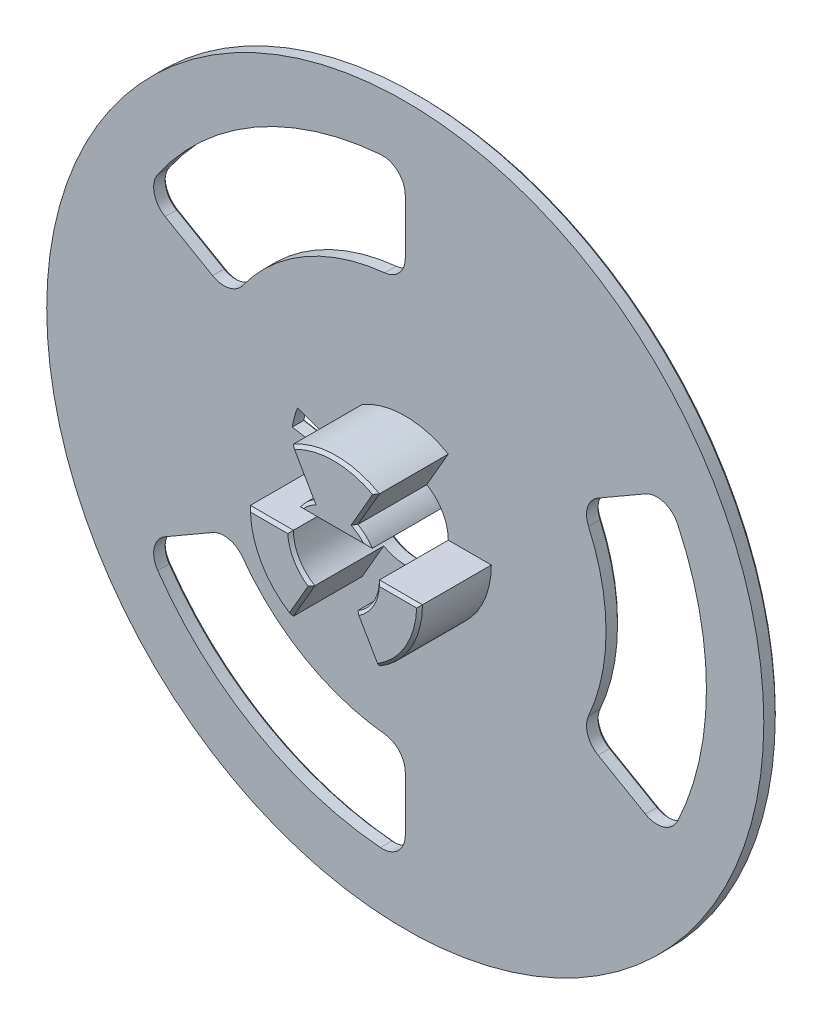
from build123d import *

# Parameters (mm, degrees)
SKETCH_1_R      = 25
EXTRUDE_1_DEPTH = 1
FILLET_1_R      = 1.6
EXTRUDE_START   = 5
EXTRUDE_3_DEPTH = 5
CHAMFER_3_SIZE  = 0.2


with BuildPart() as part:
    # 草图1 → 凸台-拉伸1 (new body)
    with BuildSketch(Plane.XY):
        Circle(SKETCH_1_R)
        with BuildLine():
            Line((-5.908846518, 1.041889066), (-7.878462024, 1.389185421))
            ThreePointArc((-7.878462024, 1.389185421), (-7.72740661, 2.070552361), (-7.517540966, 2.736161147))
            Line((-7.517540966, 2.736161147), (-5.638155725, 2.05212086))
            ThreePointArc((-5.638155725, 2.05212086), (-5.795554958, 1.552914271), (-5.908846518, 1.041889066))
        make_face(mode=Mode.SUBTRACT)
        with BuildLine():
            Line((-2.5, 1.658312395), (2.5, 1.658312395))
            ThreePointArc((2.5, 1.658312395), (0, -3), (-2.5, 1.658312395))
        make_face(mode=Mode.SUBTRACT)
        with BuildLine():
            ThreePointArc((-12.124355653, -7), (-7, -12.124355653), (0, -14))
            Line((0, -14), (0, -21))
            ThreePointArc((0, -21), (-10.5, -18.186533479), (-18.186533479, -10.5))
            Line((-18.186533479, -10.5), (-12.124355653, -7))
        make_face(mode=Mode.SUBTRACT)
        with BuildLine():
            ThreePointArc((0, 14), (-7, 12.124355653), (-12.124355653, 7))
            Line((-12.124355653, 7), (-18.186533479, 10.5))
            ThreePointArc((-18.186533479, 10.5), (-10.5, 18.186533479), (0, 21))
            Line((0, 21), (0, 14))
        make_face(mode=Mode.SUBTRACT)
        with BuildLine():
            ThreePointArc((18.186533479, 10.5), (21, 0), (18.186533479, -10.5))
            Line((18.186533479, -10.5), (12.124355653, -7))
            ThreePointArc((12.124355653, -7), (14, 0), (12.124355653, 7))
            Line((12.124355653, 7), (18.186533479, 10.5))
        make_face(mode=Mode.SUBTRACT)
    extrude(amount=-EXTRUDE_1_DEPTH)

    # 圆角1
    fillet_1_edges = [part.edges().sort_by_distance(p)[0] for p in [
        (-18.186533479, -10.5, -0.5),
        (0, -21, -0.5),
        (0, -14, -0.5),
        (-12.124355653, -7, -0.5),
        (18.186533479, -10.5, -0.5),
        (18.186533479, 10.5, -0.5),
        (12.124355653, 7, -0.5),
        (12.124355653, -7, -0.5),
        (-18.186533479, 10.5, -0.5),
        (-12.124355653, 7, -0.5),
        (0, 14, -0.5),
        (0, 21, -0.5),
    ]]
    fillet(fillet_1_edges, radius=FILLET_1_R)

    # 草图1<5> → 凸台-拉伸3 (add)
    with BuildSketch(Plane.XY.offset(EXTRUDE_START)):
        with BuildLine():
            ThreePointArc((-1.5, 2.598076211), (-2.054455891, 2.186140662), (-2.5, 1.658312395))
            Line((-2.5, 1.658312395), (2.5, 1.658312395))
            ThreePointArc((2.5, 1.658312395), (2.054455891, 2.186140662), (1.5, 2.598076211))
            Line((1.5, 2.598076211), (3, 5.196152423))
            ThreePointArc((3, 5.196152423), (0, 6), (-3, 5.196152423))
            Line((-3, 5.196152423), (-1.5, 2.598076211))
        make_face()
        with BuildLine():
            ThreePointArc((-1.5, -2.598076211), (-2.598076211, -1.5), (-3, 0))
            Line((-3, 0), (-6, 0))
            ThreePointArc((-6, 0), (-5.196152423, -3), (-3, -5.196152423))
            Line((-3, -5.196152423), (-1.5, -2.598076211))
        make_face()
        with BuildLine():
            Line((6, 0), (3, 0))
            ThreePointArc((3, 0), (2.598076211, -1.5), (1.5, -2.598076211))
            Line((1.5, -2.598076211), (3, -5.196152423))
            ThreePointArc((3, -5.196152423), (5.196152423, -3), (6, 0))
        make_face()
    extrude(amount=-EXTRUDE_3_DEPTH)

    # 倒角3
    chamfer_3_edges = [part.edges().sort_by_distance(p)[0] for p in [
        (18.021198676, 9.808386563, -1),
        (12.716572017, 6.866149549, -1),
        (12.716572017, -6.866149549, -1),
        (-17.504911272, 10.702622579, -1),
        (-12.304545944, 7.579799641, -1),
        (-0.412026073, 14.44594919, -1),
        (-0.516287404, 20.511009142, -1),
        (0, 1.658312395, -1),
        (-7.72740661, 2.070552361, -1),
        (-2.25, 3.897114317, 5),
        (0, 1.658312395, 5),
        (2.054455891, 2.186140662, 5),
        (2.25, 3.897114317, 5),
        (0, 6, 5),
        (-2.054455891, 2.186140662, 5),
        (-2.25, -3.897114317, 5),
        (-2.598076211, -1.5, 5),
        (-4.5, 0, 5),
        (-5.196152423, -3, 5),
        (4.5, 0, 5),
        (2.598076211, -1.5, 5),
        (2.25, -3.897114317, 5),
        (5.196152423, -3, 5),
        (-6.577848346, 2.394141003, -1),
        (-5.795554958, 1.552914271, -1),
        (-6.893654271, 1.215537244, -1),
        (-25, 0, -1),
        (-10.5, -18.186533479, -1),
        (-15.091202728, -8.712909958, -1),
        (-7, -12.124355653, -1),
        (0, -17.425819915, -1),
        (21, 0, -1),
        (15.091202728, -8.712909958, -1),
        (15.091202728, 8.712909958, -1),
        (14, 0, -1),
        (-15.091202728, 8.712909958, -1),
        (-10.5, 18.186533479, -1),
        (-7, 12.124355653, -1),
        (0, 17.425819915, -1),
        (-17.504911272, -10.702622579, -1),
        (0, -3, -1),
        (-12.304545944, -7.579799641, -1),
        (-0.412026073, -14.44594919, -1),
        (-0.516287404, -20.511009142, -1),
        (18.021198676, -9.808386563, -1),
    ]]
    chamfer(chamfer_3_edges, length=CHAMFER_3_SIZE)


solid = part.part
